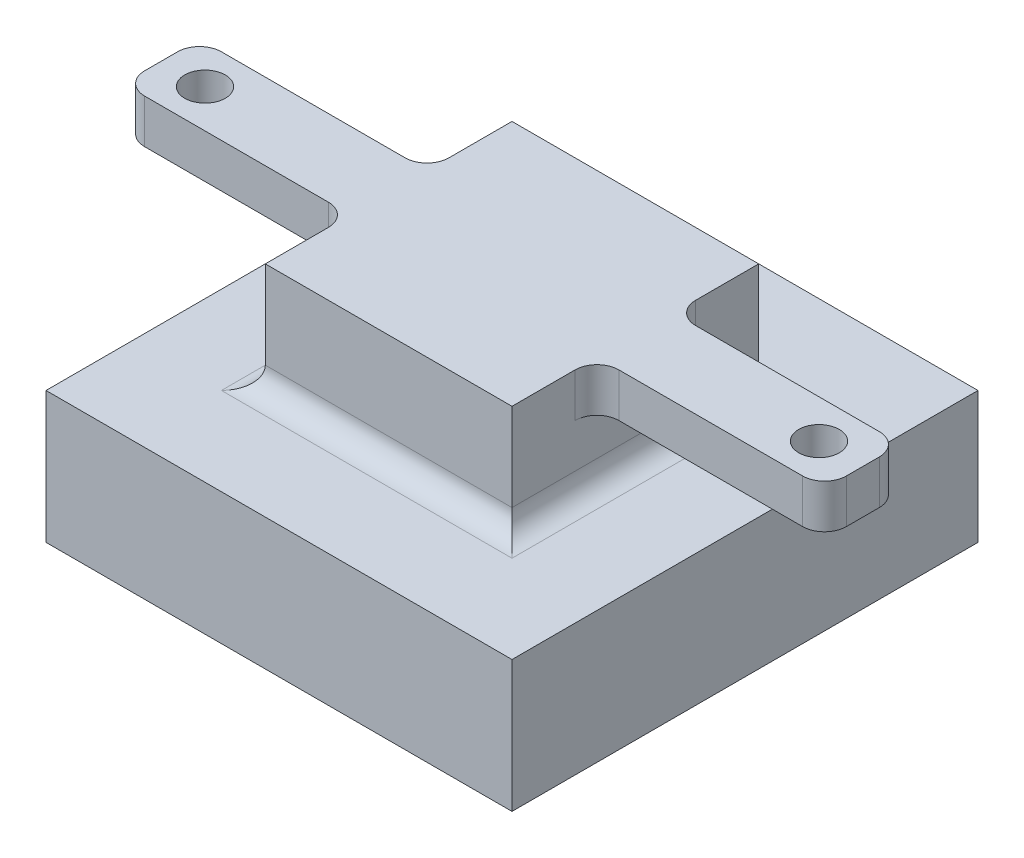
from build123d import *

# Parameters (mm, degrees)
SKETCH1_W           = 42.5
SKETCH1_H           = 42.5
SKETCH1_W_2         = 38.5
SKETCH1_H_2         = 38.5
BOSS_EXTRUDE1_DEPTH = 10
SKETCH2_W           = 42.5
SKETCH2_H           = 42.5
BOSS_EXTRUDE2_DEPTH = 2
SKETCH3_W           = 4
SKETCH3_H           = 2
CUT_EXTRUDE1_DEPTH  = 10
SKETCH5_W           = 22.5
SKETCH5_H           = 22.5
BOSS_EXTRUDE3_DEPTH = 10
BOSS_EXTRUDE4_DEPTH = 4
FILLET1_R           = 2
FILLET2_R           = 3


with BuildPart() as part:
    # Sketch1 → Boss-Extrude1 (new body)
    with BuildSketch(Plane(origin=(0, 0, 0), x_dir=(1, 0, 0), z_dir=(0, 1, 0))):
        Rectangle(SKETCH1_W, SKETCH1_H)
        Rectangle(SKETCH1_W_2, SKETCH1_H_2, mode=Mode.SUBTRACT)
    extrude(amount=BOSS_EXTRUDE1_DEPTH)

    # Sketch2 → Boss-Extrude2 (add)
    with BuildSketch(Plane(origin=(0, 10, 0), x_dir=(1, 0, 0), z_dir=(0, 1, 0))):
        Rectangle(SKETCH2_W, SKETCH2_H)
    extrude(amount=BOSS_EXTRUDE2_DEPTH)

    # Sketch3 → Cut-Extrude1 (cut)
    with BuildSketch(Plane.XZ):
        with Locations((-2, -20.25)):
            Rectangle(SKETCH3_W, SKETCH3_H)
        with Locations((2, -20.25)):
            Rectangle(SKETCH3_W, SKETCH3_H)
    extrude(amount=-CUT_EXTRUDE1_DEPTH, mode=Mode.SUBTRACT)

    # Sketch5 → Boss-Extrude3 (add)
    with BuildSketch(Plane(origin=(0, 12, 0), x_dir=(1, 0, 0), z_dir=(0, 1, 0))):
        Rectangle(SKETCH5_W, SKETCH5_H)
    extrude(amount=BOSS_EXTRUDE3_DEPTH)

    # Sketch6 → Boss-Extrude4 (add)
    with BuildSketch(Plane(origin=(0, 22, 0), x_dir=(1, 0, 0), z_dir=(0, 1, 0))):
        with BuildLine():
            Line((32, 0), (29.85, 0))
            ThreePointArc((29.85, 0), (28, -1.85), (26.15, 0))
            Line((26.15, 0), (11.25, 0))
            Line((11.25, 0), (11.25, -3.5))
            Line((11.25, -3.5), (32, -3.5))
            Line((32, -3.5), (32, 0))
        make_face()
        with BuildLine():
            ThreePointArc((26.15, 0), (28, 1.85), (29.85, 0))
            Line((29.85, 0), (32, 0))
            Line((32, 0), (32, 3.5))
            Line((32, 3.5), (11.25, 3.5))
            Line((11.25, 3.5), (11.25, 0))
            Line((11.25, 0), (26.15, 0))
        make_face()
    boss_extrude4 = extrude(amount=-BOSS_EXTRUDE4_DEPTH)

    # Mirror2: Boss-Extrude4 across plane
    add(boss_extrude4.mirror(Plane(origin=(0, 0, 0), x_dir=(0, 0, 1), z_dir=(1, 0, 0))))

    # Fillet1
    fillet1_edges = [part.edges().sort_by_distance(p)[0] for p in [
        (0, 12, -11.25),
        (-11.25, 12, 0),
        (0, 12, 11.25),
        (11.25, 12, 0),
        (11.25, 20, -3.5),
        (32, 20, -3.5),
        (32, 20, 3.5),
        (11.25, 20, 3.5),
        (-32, 20, -3.5),
        (-11.25, 20, -3.5),
        (-11.25, 20, 3.5),
        (-32, 20, 3.5),
    ]]
    fillet(fillet1_edges, radius=FILLET1_R)

    # Fillet2
    fillet2_edges = [part.edges().sort_by_distance(p)[0] for p in [
        (4, 0, -20.25),
        (-4, 0, -20.25),
    ]]
    fillet(fillet2_edges, radius=FILLET2_R)


solid = part.part
